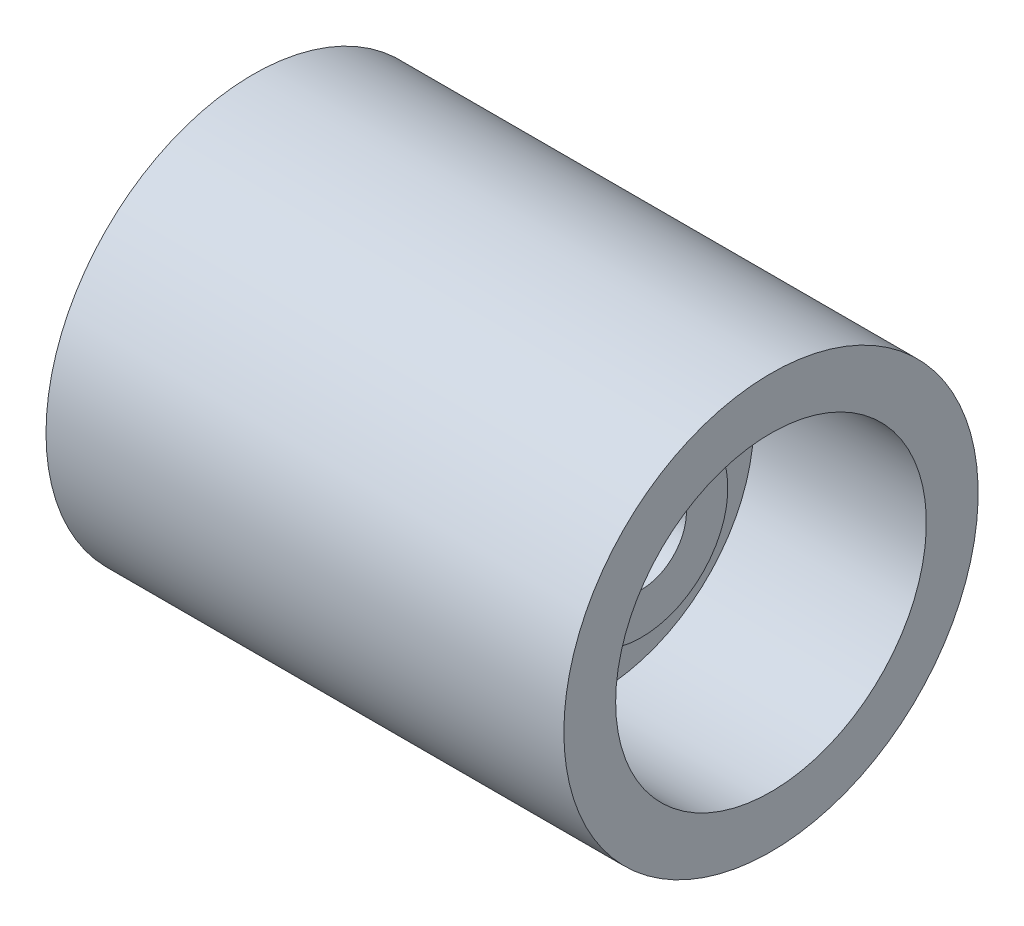
from build123d import *

# Parameters (mm, degrees)
SKETCH2_R          = 2.6
CUT_EXTRUDE1_DEPTH = 29.182441342


with BuildPart() as part:
    # Sketch1 → Revolve1 (revolve)
    with BuildSketch(Plane.XY, mode=Mode.PRIVATE) as revolve1_sk:
        Polygon((-7.5, 0), (-7.5, 5), (-5, 5), (-5, 9), (-15, 9), (-15, 12), (15, 12), (15, 9), (5, 9), (5, 5), (7.5, 5), (7.5, 0), align=None)
    revolve(revolve1_sk.sketch.rotate(Axis((0, 0, 0), (1, 0, 0)), 90), axis=Axis((0, 0, 0), (1, 0, 0)))

    # Sketch2 → Cut-Extrude1 (cut, through all)
    with BuildSketch(Plane.ZY.offset(7.5)):
        Circle(SKETCH2_R)
    extrude(amount=-CUT_EXTRUDE1_DEPTH, mode=Mode.SUBTRACT)


solid = part.part
